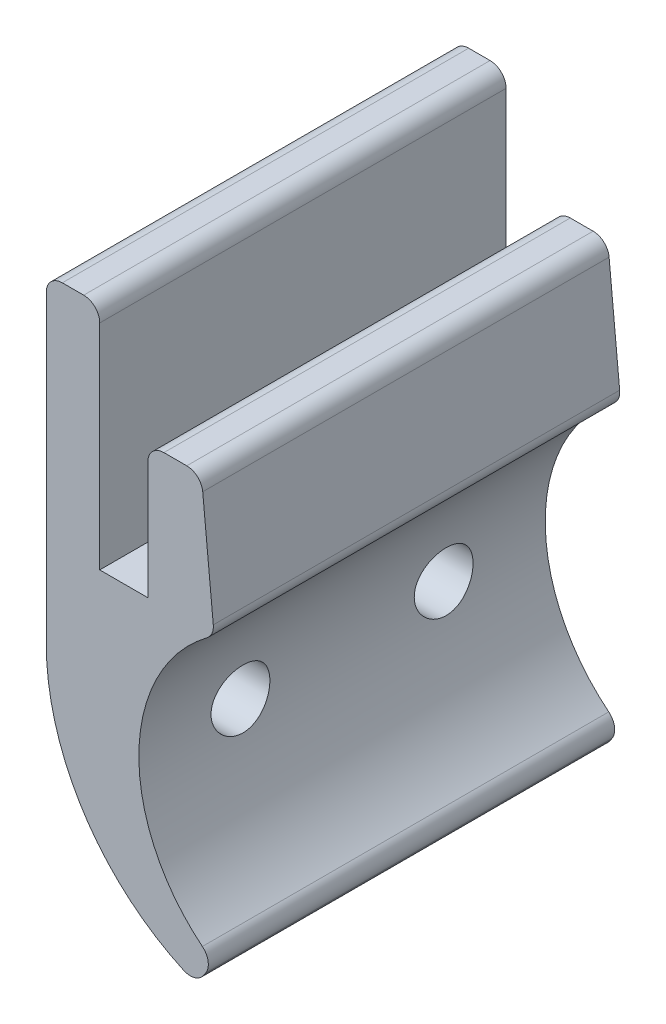
from build123d import *

# Parameters (mm, degrees)
RESSALTO_EXTRUS_O1_DEPTH                             = 19
FILETE1_R                                            = 1.5
RESSALTO_EXTRUS_O2_DEPTH                             = 2.5
REBAIXO_PARA_PARAFUSO_ALLEN_SEXTAVADO_DE_D           = 5.5
REBAIXO_PARA_PARAFUSO_ALLEN_SEXTAVADO_DE_CBORE_D     = 11.5
REBAIXO_PARA_PARAFUSO_ALLEN_SEXTAVADO_DE_CBORE_DEPTH = 3


with BuildPart() as part:
    # Esboço1 → Ressalto-extrusão1 (new, symmetric)
    with BuildSketch(Plane.XY):
        with BuildLine():
            Line((0, 0), (0, -30))
            ThreePointArc((0, -30), (3.840309651, -42.417932709), (14.020349891, -50.5))
            Line((14.020349891, -50.5), (15.7, -48.014285714))
            ThreePointArc((15.7, -48.014285714), (8.658133916, -34.757142857), (15.7, -21.5))
            Line((15.7, -21.5), (14.5, -9))
            Line((14.5, -9), (9.5, -9))
            Line((9.5, -9), (9.5, -21.5))
            Line((9.5, -21.5), (5, -21.5))
            Line((5, -21.5), (5, 0))
            Line((5, 0), (0, 0))
        make_face()
    extrude(amount=RESSALTO_EXTRUS_O1_DEPTH, both=True)

    # Filete1
    filete1_edges = [part.edges().sort_by_distance(p)[0] for p in [
        (5, 0, 0),
        (9.5, -9, 0),
        (14.5, -9, 0),
        (15.7, -21.5, 0),
        (15.7, -48.014285714, 0),
        (14.020349891, -50.5, 0),
        (0, 0, 0),
    ]]
    fillet(filete1_edges, radius=FILETE1_R)

    # Esboço3 → Ressalto-extrusão2 (add, symmetric)
    with BuildSketch(Plane.XY):
        with BuildLine():
            Line((0, -1.5), (-5, -6.5))
            Line((-5, -6.5), (-5, -24.5))
            ThreePointArc((-5, -24.5), (-0.096122461, -40.062531476), (12.8437502, -50.002355236))
            ThreePointArc((12.8437502, -50.002355236), (3.487375513, -41.885454705), (0, -30))
            Line((0, -30), (0, -1.5))
        make_face()
    extrude(amount=RESSALTO_EXTRUS_O2_DEPTH, both=True)

    # Rebaixo para parafuso Allen sextavado de M51 (through all)
    with Locations(Plane.ZY):
        with Locations((-9.5, -34.75), (9.5, -34.75)):
            CounterBoreHole(REBAIXO_PARA_PARAFUSO_ALLEN_SEXTAVADO_DE_D / 2, REBAIXO_PARA_PARAFUSO_ALLEN_SEXTAVADO_DE_CBORE_D / 2, REBAIXO_PARA_PARAFUSO_ALLEN_SEXTAVADO_DE_CBORE_DEPTH)


solid = part.part
